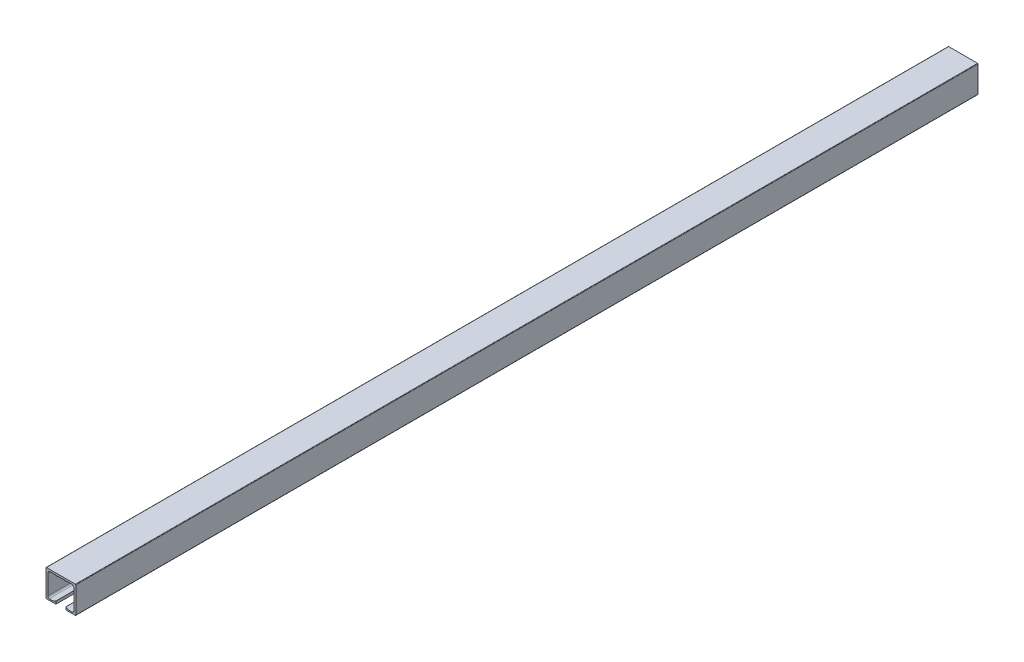
from build123d import *

# Parameters (mm, degrees)
EXTRUDE_1_DEPTH = 1000


with BuildPart() as part:
    # 草图1 → 凸台-拉伸1 (new body)
    with BuildSketch(Plane.XY):
        with BuildLine():
            Line((10.5, -30), (0, -30))
            ThreePointArc((0, -30), (-0.353553391, -29.853553391), (-0.5, -29.5))
            Line((-0.5, -29.5), (-0.5, -0.5))
            ThreePointArc((-0.5, -0.5), (-0.353553391, -0.146446609), (0, 0))
            Line((0, 0), (32, 0))
            ThreePointArc((32, 0), (32.353553391, -0.146446609), (32.5, -0.5))
            Line((32.5, -0.5), (32.5, -29.5))
            ThreePointArc((32.5, -29.5), (32.353553391, -29.853553391), (32, -30))
            Line((32, -30), (21.5, -30))
            Line((21.5, -30), (21.5, -27))
            ThreePointArc((21.5, -27), (25.038664483, -28.385121551), (28.838528773, -28.426827781))
            ThreePointArc((28.838528773, -28.426827781), (30.029224893, -27.744667111), (30.5, -26.455686418))
            Line((30.5, -26.455686418), (30.5, -5))
            ThreePointArc((30.5, -5), (29.621320344, -2.878679656), (27.5, -2))
            Line((27.5, -2), (21.562207583, -2))
            Line((21.562207583, -2), (21.175427925, -2.706444665))
            ThreePointArc((21.175427925, -2.706444665), (21, -2.810397577), (20.824572075, -2.706444665))
            Line((20.824572075, -2.706444665), (20.437792417, -2))
            Line((20.437792417, -2), (11.562207583, -2))
            Line((11.562207583, -2), (11.175427925, -2.706444665))
            ThreePointArc((11.175427925, -2.706444665), (11, -2.810397577), (10.824572075, -2.706444665))
            Line((10.824572075, -2.706444665), (10.437792417, -2))
            Line((10.437792417, -2), (4.5, -2))
            ThreePointArc((4.5, -2), (2.378679656, -2.878679656), (1.5, -5))
            Line((1.5, -5), (1.5, -26.455686418))
            ThreePointArc((1.5, -26.455686418), (1.970775107, -27.744667111), (3.161471227, -28.426827781))
            ThreePointArc((3.161471227, -28.426827781), (6.961335517, -28.385121551), (10.5, -27))
            Line((10.5, -27), (10.5, -30))
        make_face()
    extrude(amount=EXTRUDE_1_DEPTH)


solid = part.part
